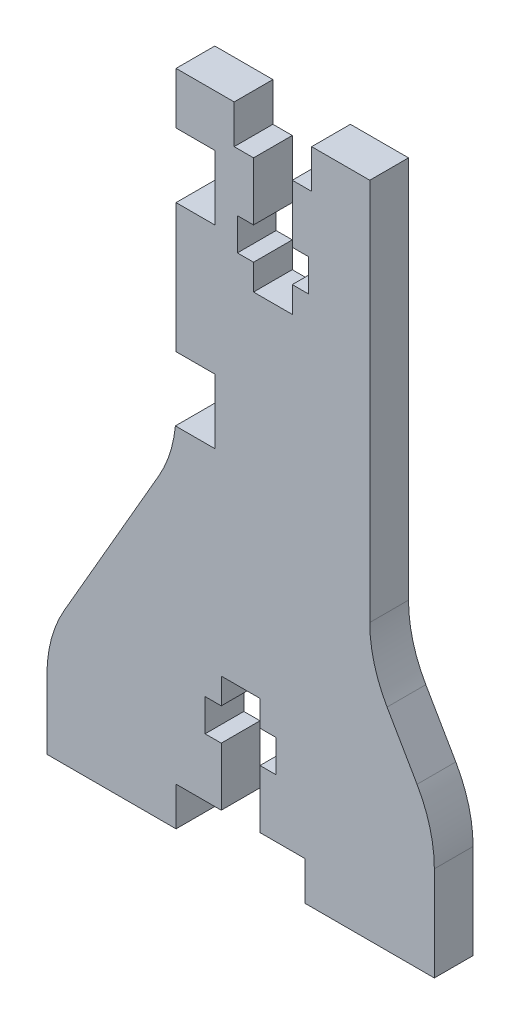
from build123d import *

# Parameters (mm, degrees)
CROQUIS1_W              = 10
CROQUIS1_H              = 3
SALIENTE_EXTRUIR1_DEPTH = 3
REDONDEO1_R             = 10
CROQUIS2_W              = 6
CROQUIS2_H              = 3
CORTAR_EXTRUIR1_DEPTH   = 3
CROQUIS3_W              = 1.25
CROQUIS3_H              = 2.5
CROQUIS3_W_2            = 3
CROQUIS3_H_2            = 7.5
CROQUIS3_H_3            = 2
CORTAR_EXTRUIR2_DEPTH   = 32.032241298
CROQUIS4_W              = 3
CROQUIS4_H              = 5
CROQUIS4_W_2            = 4
CORTAR_EXTRUIR3_DEPTH   = 32.032241298
CROQUIS5_W              = 3
CROQUIS5_H              = 7.5
CROQUIS5_H_2            = 2.5
CROQUIS5_W_2            = 1.25
CROQUIS5_H_3            = 2
CORTAR_EXTRUIR4_DEPTH   = 32.032241298


with BuildPart() as part:
    # Croquis1 → Saliente-Extruir1 (new body)
    with BuildSketch(Plane.XY):
        Polygon((15, -17), (15, -24), (-15, -24), (-15, -19), (-5, -1.679491924), (-5, 24), (10, 24), (10, -8.339745962), align=None)
        with Locations((-10, -25.5)):
            Rectangle(CROQUIS1_W, CROQUIS1_H)
        with Locations((10, -25.5)):
            Rectangle(CROQUIS1_W, CROQUIS1_H)
    extrude(amount=SALIENTE_EXTRUIR1_DEPTH)

    # Redondeo1
    redondeo1_edges = [part.edges().sort_by_distance(p)[0] for p in [
        (-15, -19, 1.5),
        (-5, -1.679491924, 1.5),
        (10, -8.339745962, 1.5),
        (15, -17, 1.5),
    ]]
    fillet(redondeo1_edges, radius=REDONDEO1_R)

    # Croquis2 → Cortar-Extruir1 (cut)
    with BuildSketch(Plane.XY):
        with Locations((2.5, 22.5)):
            Rectangle(CROQUIS2_W, CROQUIS2_H)
    extrude(amount=CORTAR_EXTRUIR1_DEPTH, mode=Mode.SUBTRACT)

    # Croquis3 → Cortar-Extruir2 (cut, through all)
    with BuildSketch(Plane.XY):
        with Locations((0.375, 15.25)):
            Rectangle(CROQUIS3_W, CROQUIS3_H)
        with Locations((2.5, 15.25)):
            Rectangle(CROQUIS3_W_2, CROQUIS3_H)
        with Locations((4.625, 15.25)):
            Rectangle(CROQUIS3_W, CROQUIS3_H)
        with Locations((2.5, 20.25)):
            Rectangle(CROQUIS3_W_2, CROQUIS3_H_2)
        with Locations((2.5, 13)):
            Rectangle(CROQUIS3_W_2, CROQUIS3_H_3)
    extrude(amount=CORTAR_EXTRUIR2_DEPTH, mode=Mode.SUBTRACT)

    # Croquis4 → Cortar-Extruir3 (cut, through all)
    with BuildSketch(Plane.XY):
        with Locations((-3.5, 17.5)):
            Rectangle(CROQUIS4_W, CROQUIS4_H)
        with Locations((-4, 2.5)):
            Rectangle(CROQUIS4_W_2, CROQUIS4_H)
    extrude(amount=CORTAR_EXTRUIR3_DEPTH, mode=Mode.SUBTRACT)

    # Croquis5 → Cortar-Extruir4 (cut, through all)
    with BuildSketch(Plane.XY):
        with Locations((0, -23.25)):
            Rectangle(CROQUIS5_W, CROQUIS5_H)
        with Locations((0, -18.25)):
            Rectangle(CROQUIS5_W, CROQUIS5_H_2)
        with Locations((-2.125, -18.25)):
            Rectangle(CROQUIS5_W_2, CROQUIS5_H_2)
        with Locations((2.125, -18.25)):
            Rectangle(CROQUIS5_W_2, CROQUIS5_H_2)
        with Locations((0, -16)):
            Rectangle(CROQUIS5_W, CROQUIS5_H_3)
    extrude(amount=CORTAR_EXTRUIR4_DEPTH, mode=Mode.SUBTRACT)


solid = part.part
